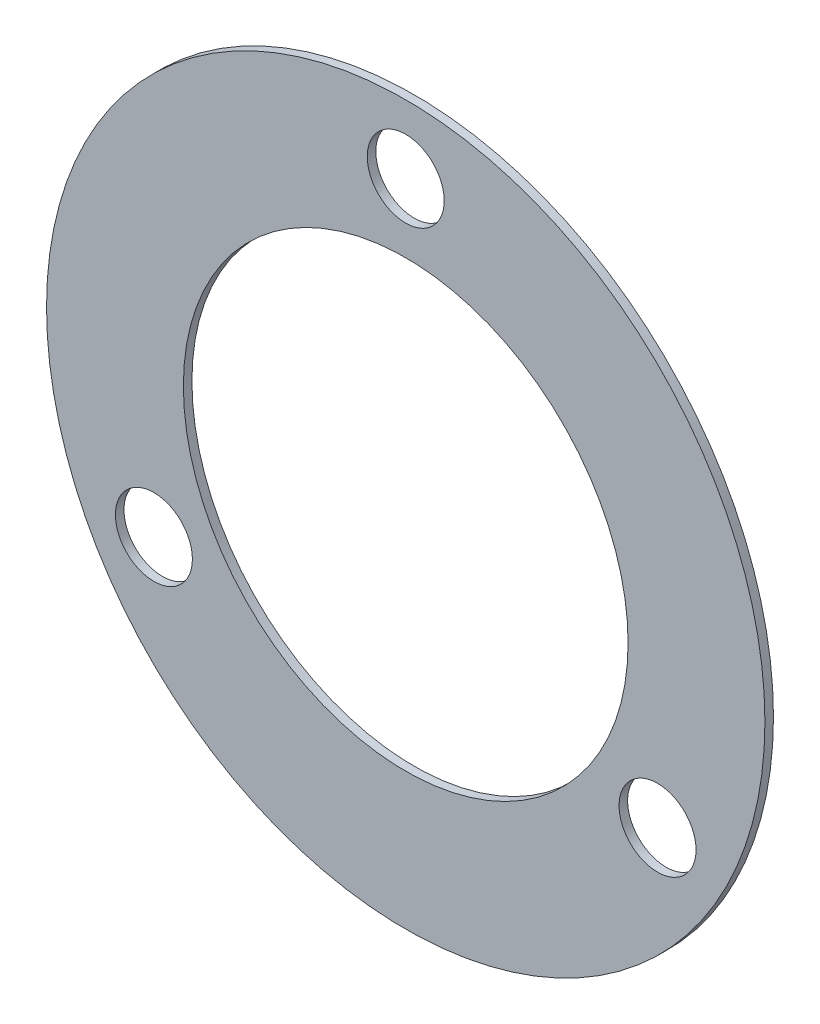
from build123d import *

# Parameters (mm, degrees)
SCHIZZO1_R                   = 42
SCHIZZO1_R_2                 = 26
SCHIZZO1_R_3                 = 4.5
ESTRUSIONE_ESTRUSIONE1_DEPTH = 1


with BuildPart() as part:
    # Schizzo1 → Estrusione-Estrusione1 (new body)
    with BuildSketch(Plane.XY):
        Circle(SCHIZZO1_R)
        Circle(SCHIZZO1_R_2, mode=Mode.SUBTRACT)
        with Locations((0, 34)):
            Circle(SCHIZZO1_R_3, mode=Mode.SUBTRACT)
        with Locations((29.444863729, -17)):
            Circle(SCHIZZO1_R_3, mode=Mode.SUBTRACT)
        with Locations((-29.444863729, -17)):
            Circle(SCHIZZO1_R_3, mode=Mode.SUBTRACT)
    extrude(amount=ESTRUSIONE_ESTRUSIONE1_DEPTH)


solid = part.part
